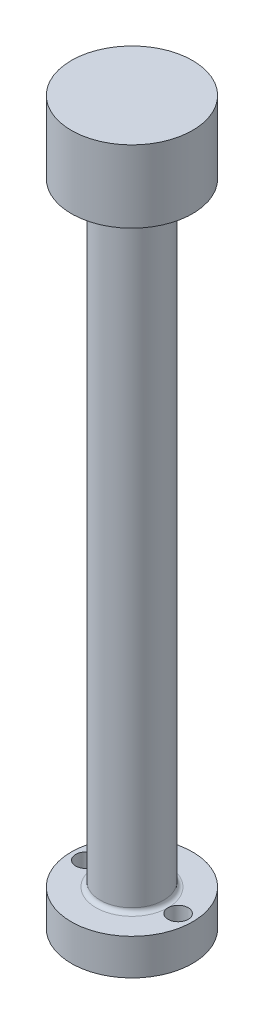
from build123d import *

# Parameters (mm, degrees)
SKETCH2_R          = 1.7779999999999996
CUT_EXTRUDE1_DEPTH = 6.35
FILLET1_R          = 1.27
FILLET2_R          = 0.762


with BuildPart() as part:
    # Sketch1 → Revolve1 (revolve)
    with BuildSketch(Plane.XY, mode=Mode.PRIVATE) as revolve1_sk:
        Polygon((0, 0), (10.668, 0), (10.668000000000001, 6.35), (5.588, 6.349999999999999), (5.588, 114.30000000000001), (10.668000000000001, 114.3), (10.668, 127), (-1.12e-14, 127), align=None)
    revolve(revolve1_sk.sketch.rotate(Axis((-1.12e-14, 127, 0), (9e-17, -1, 0)), 180), axis=Axis((-1.12e-14, 127, 0), (9e-17, -1, 0)))

    # Sketch2 → Cut-Extrude1 (cut)
    with BuildSketch(Plane(origin=(-5.6e-16, 6.349999999999999, 0), x_dir=(1, -1.7e-16, 0), z_dir=(1.7e-16, 1, 0))):
        with Locations(Location((-8.128000000000021, -4.5e-16, 0), (0, 0, 180))):
            Circle(SKETCH2_R)
        with Locations(Location((8.128000000000021, -4.5e-16, 0), (0, 0, 180))):
            Circle(SKETCH2_R)
    extrude(amount=-CUT_EXTRUDE1_DEPTH, mode=Mode.SUBTRACT)

    # Fillet1
    fillet1_edges = [part.edges().sort_by_distance(p)[0] for p in [
        (5.588000000000001, 114.30000000000001, -1.37e-15),
    ]]
    fillet(fillet1_edges, radius=FILLET1_R)

    # Fillet2
    fillet2_edges = [part.edges().sort_by_distance(p)[0] for p in [
        (5.587999999999999, 6.349999999999995, -3.85e-15),
    ]]
    fillet(fillet2_edges, radius=FILLET2_R)


solid = part.part
